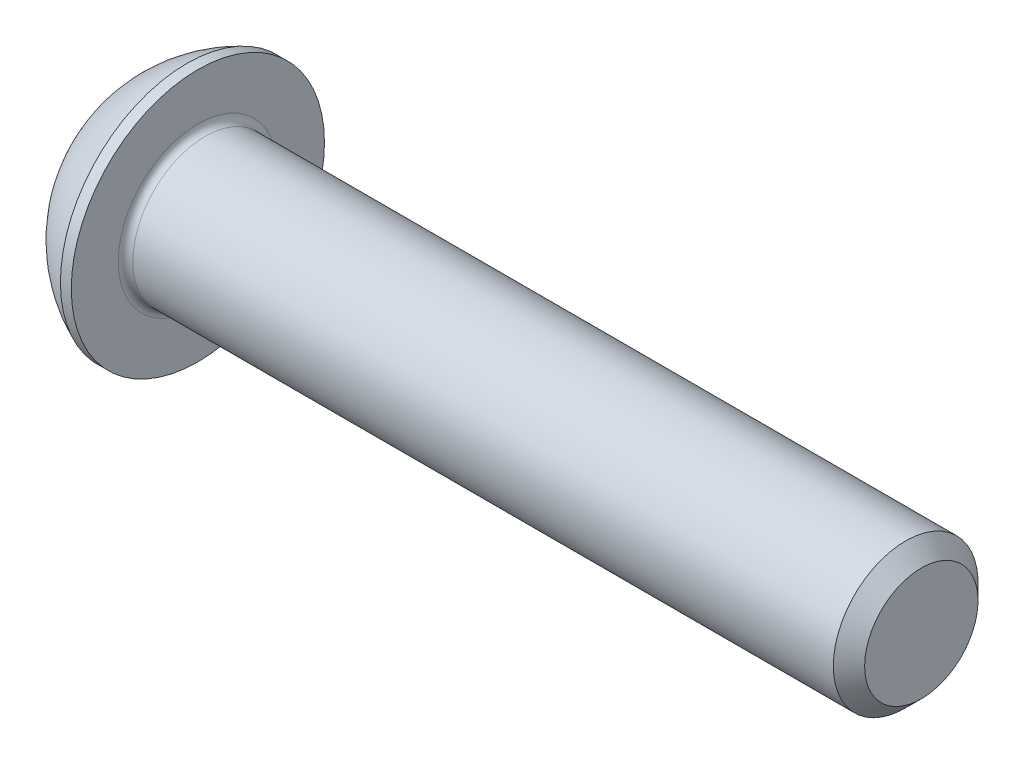
from build123d import *

# Parameters (mm, degrees)
FILLET1_R   = 0.1
HEX_2_DEPTH = 0.6


with BuildPart() as part:
    # BodySke → BaseBody (revolve)
    with BuildSketch(Plane.XY, mode=Mode.PRIVATE) as basebody_sk:
        with BuildLine():
            Line((11.1, 0), (11.1, 0.7835))
            Line((11.1, 0.7835), (10.8835, 1))
            Line((10.8835, 1), (1.1, 1))
            Line((1.1, 1), (1.1, 1.75))
            Line((1.1, 1.75), (0.95, 1.75))
            ThreePointArc((0.95, 1.75), (0.398268526, 1.395808457), (0, 0.875))
            Line((0, 0.875), (0, 0))
            Line((0, 0), (11.1, 0))
        make_face()
    revolve(basebody_sk.sketch.rotate(Axis((0, 0, 0), (1, 0, 0)), 90), axis=Axis((0, 0, 0), (1, 0, 0)))

    # Fillet1
    fillet1_edges = [part.edges().sort_by_distance(p)[0] for p in [
        (1.1, 0, -1),
    ]]
    fillet(fillet1_edges, radius=FILLET1_R)

    # Sketch2 → PreBroach (revolve, cut)
    with BuildSketch(Plane.XY, mode=Mode.PRIVATE) as prebroach_sk:
        Polygon((0, 0.715), (0.6, 0.715), (1.012805442, 0), (0, 0), align=None)
    revolve(prebroach_sk.sketch.rotate(Axis((0, 0, 0), (1, 0, 0)), 90), axis=Axis((0, 0, 0), (1, 0, 0)), mode=Mode.SUBTRACT)

    # Sketch3 → Hex 2 (cut)
    with BuildSketch(Plane(origin=(0, 0, 0), x_dir=(0, 0, -1), z_dir=(1, 0, 0))):
        Polygon((-0.65, -0.375277675), (-0.65, 0.375277675), (0, 0.75055535), (0.65, 0.375277675), (0.65, -0.375277675), (0, -0.75055535), align=None)
    extrude(amount=HEX_2_DEPTH, mode=Mode.SUBTRACT)


solid = part.part
